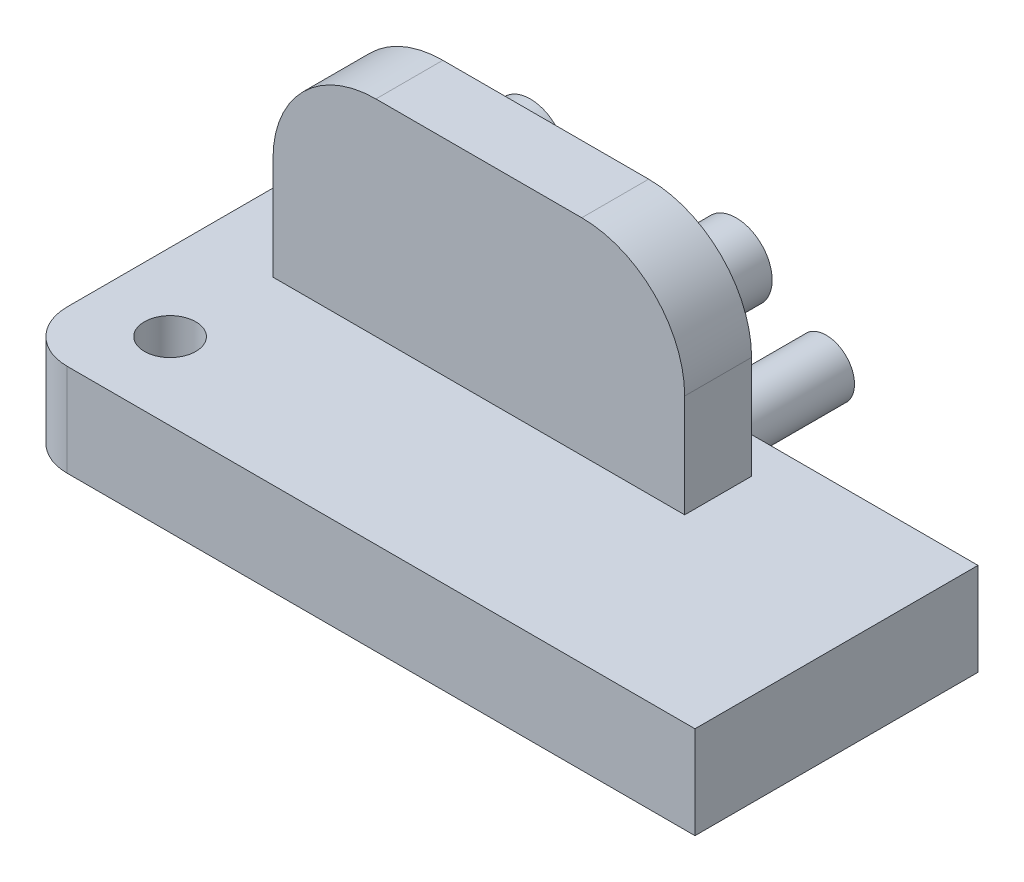
from build123d import *

# Parameters (mm, degrees)
BOSS_EXTRUDE2_DEPTH      = 8
BOSS_EXTRUDE2_DEPTH_BACK = 1
SKETCH1_R                = 2.5
CUT_EXTRUDE1_START       = -16
SKETCH2_R                = 2.5
CUT_EXTRUDE1_DEPTH       = 16
SKETCH3_R                = 2.75
BOSS_EXTRUDE3_DEPTH      = 13.75
SKETCH4_W                = 9
SKETCH4_H                = 6.5
BOSS_EXTRUDE4_DEPTH      = 15
BOSS_EXTRUDE5_DEPTH      = 8.5
SKETCH8_W                = 9
SKETCH8_H                = 6.5
BOSS_EXTRUDE6_DEPTH      = 5
SKETCH9_W                = 15.5
SKETCH9_H                = 6.5
BOSS_EXTRUDE7_DEPTH      = 20
SKETCH10_R               = 3.5
BOSS_EXTRUDE8_DEPTH      = 8.5
CUT_EXTRUDE2_START       = -8.5
SKETCH12_R               = 3.5
CUT_EXTRUDE2_DEPTH       = 8.5
FILLET1_R                = 10
BOSS_EXTRUDE9_DEPTH      = 11
BOSS_EXTRUDE9_DEPTH_BACK = 11
SKETCH13_W               = 27.5
SKETCH13_H               = 9


with BuildPart() as part:
    # Sketch1 → Boss-Extrude2 (new, two sides: drawn at the far end of the back side and taken through both)
    with BuildSketch(Plane(origin=(0, 0, 0), x_dir=(1, 0, 0), z_dir=(0, 1, 0)).offset(-BOSS_EXTRUDE2_DEPTH_BACK)):
        with BuildLine():
            Line((5, 0), (50, 0))
            ThreePointArc((50, 0), (53.535533906, 1.464466094), (55, 5))
            Line((55, 5), (55, 50))
            ThreePointArc((55, 50), (53.535533906, 53.535533906), (50, 55))
            Line((50, 55), (5, 55))
            ThreePointArc((5, 55), (1.464466094, 53.535533906), (0, 50))
            Line((0, 50), (0, 5))
            ThreePointArc((0, 5), (1.464466094, 1.464466094), (5, 0))
        make_face()
        with Locations((7.5, 47.5)):
            Circle(SKETCH1_R, mode=Mode.SUBTRACT)
        with Locations((47.5, 47.5)):
            Circle(SKETCH1_R, mode=Mode.SUBTRACT)
        with Locations((47.5, 7.5)):
            Circle(SKETCH1_R, mode=Mode.SUBTRACT)
        with Locations((7.5, 7.5)):
            Circle(SKETCH1_R, mode=Mode.SUBTRACT)
    extrude(amount=BOSS_EXTRUDE2_DEPTH + BOSS_EXTRUDE2_DEPTH_BACK)

    # Sketch2 → Cut-Extrude1 (cut)
    with BuildSketch(Plane(origin=(0, 8, 0), x_dir=(1, 0, 0), z_dir=(0, 1, 0)).offset(CUT_EXTRUDE1_START)):
        with BuildLine():
            Line((0, 50), (0, 27.5))
            Line((0, 27.5), (55, 27.5))
            Line((55, 27.5), (55, 50))
            ThreePointArc((55, 50), (53.535533906, 53.535533906), (50, 55))
            Line((50, 55), (5, 55))
            ThreePointArc((5, 55), (1.464466094, 53.535533906), (0, 50))
        make_face()
        with Locations((7.5, 47.5)):
            Circle(SKETCH2_R, mode=Mode.SUBTRACT)
        with Locations((47.5, 47.5)):
            Circle(SKETCH2_R, mode=Mode.SUBTRACT)
    extrude(amount=CUT_EXTRUDE1_DEPTH, mode=Mode.SUBTRACT)

    # Sketch3 → Boss-Extrude3 (add)
    with BuildSketch(Plane(origin=(0, 0, -27.5), x_dir=(-1, 0, 0), z_dir=(0, 0, -1))):
        with Locations((-37.5, 3.5)):
            Circle(SKETCH3_R)
        with Locations((-17.5, 3.5)):
            Circle(SKETCH3_R)
    extrude(amount=BOSS_EXTRUDE3_DEPTH)

    # Sketch4 → Boss-Extrude4 (add)
    with BuildSketch(Plane(origin=(0, 8, 0), x_dir=(1, 0, 0), z_dir=(0, 1, 0))):
        with Locations((27.5, 20.75)):
            Rectangle(SKETCH4_W, SKETCH4_H)
    extrude(amount=BOSS_EXTRUDE4_DEPTH)

    # Sketch5 → Boss-Extrude5 (add)
    with BuildSketch(Plane(origin=(0, 0, -24), x_dir=(-1, 0, 0), z_dir=(0, 0, -1))):
        with BuildLine():
            ThreePointArc((-25.636419782, 13.037388184), (-24.436298745, 14.307742745), (-24, 16))
            ThreePointArc((-24, 16), (-29.974873734, 18.474873734), (-27.5, 12.5))
            ThreePointArc((-27.5, 12.5), (-26.685966178, 12.595980474), (-25.916578842, 12.878657751))
            ThreePointArc((-25.916578842, 12.878657751), (-25.85405917, 13.094916041), (-25.636419782, 13.037388184))
        make_face()
    extrude(amount=BOSS_EXTRUDE5_DEPTH)

    # Sketch8 → Boss-Extrude6 (add)
    with BuildSketch(Plane(origin=(0, 23, 0), x_dir=(1, 0, 0), z_dir=(0, 1, 0))):
        with Locations((27.5, 20.75)):
            Rectangle(SKETCH8_W, SKETCH8_H)
    extrude(amount=BOSS_EXTRUDE6_DEPTH)

    # Sketch9 → Boss-Extrude7 (add)
    with BuildSketch(Plane(origin=(0, 8, 0), x_dir=(1, 0, 0), z_dir=(0, 1, 0))):
        with Locations((39.75, 20.75)):
            Rectangle(SKETCH9_W, SKETCH9_H)
        with Locations((15.25, 20.75)):
            Rectangle(SKETCH9_W, SKETCH9_H)
    extrude(amount=BOSS_EXTRUDE7_DEPTH)

    # Sketch10 → Boss-Extrude8 (add)
    with BuildSketch(Plane(origin=(0, 0, -24), x_dir=(-1, 0, 0), z_dir=(0, 0, -1))):
        with Locations((-17.5, 17)):
            Circle(SKETCH10_R)
        with Locations((-37.5, 17)):
            Circle(SKETCH10_R)
    extrude(amount=BOSS_EXTRUDE8_DEPTH)

    # Sketch12 → Cut-Extrude2 (cut)
    with BuildSketch(Plane(origin=(0, 0, -32.5), x_dir=(-1, 0, 0), z_dir=(0, 0, -1)).offset(CUT_EXTRUDE2_START)):
        with Locations((-27.5, 16)):
            Circle(SKETCH12_R)
    extrude(amount=CUT_EXTRUDE2_DEPTH, mode=Mode.SUBTRACT)

    # Fillet1
    fillet1_edges = [part.edges().sort_by_distance(p)[0] for p in [
        (47.5, 28, -20.75),
        (7.5, 28, -20.75),
    ]]
    fillet(fillet1_edges, radius=FILLET1_R)

    # Sketch13 → Boss-Extrude9 (add, two sides: drawn at the far end of the back side and taken through both)
    with BuildSketch(Plane(origin=(55, 0, 0), x_dir=(0, 0, -1), z_dir=(1, 0, 0)).offset(-BOSS_EXTRUDE9_DEPTH_BACK)):
        with Locations((13.75, 3.5)):
            Rectangle(SKETCH13_W, SKETCH13_H)
    extrude(amount=BOSS_EXTRUDE9_DEPTH + BOSS_EXTRUDE9_DEPTH_BACK)


solid = part.part
